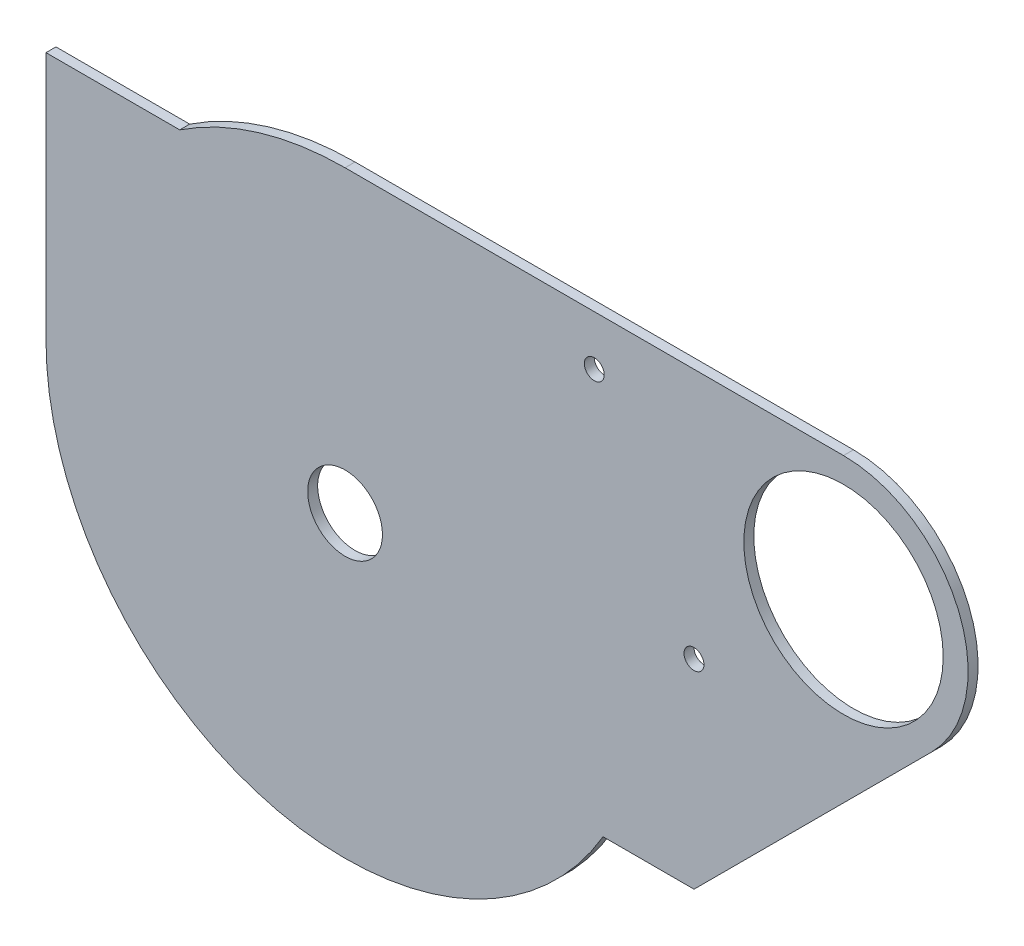
from build123d import *

# Parameters (mm, degrees)
SKETCH1_R           = 20
SKETCH1_R_2         = 7.5
BOSS_EXTRUDE1_DEPTH = 2
CUT_EXTRUDE1_REACH  = 140.669
SKETCH3_R           = 2


with BuildPart() as part:
    # Sketch1 → Boss-Extrude1 (new body)
    # profile 1 of 2: a face of its own
    with BuildSketch(Plane.XY):
        with BuildLine():
            ThreePointArc((-60, 0), (-52.867640737, 28.372743309), (-33.166247904, 50))
            Line((-33.166247904, 50), (-60, 50))
            Line((-60, 50), (-60, 0))
        make_face()
    # profile 2 of 2: a face of its own
    with BuildSketch(Plane.XY):
        with BuildLine():
            Line((117.67766953, 17.32233047), (70.010033914, -30.345305145))
            Line((70.010033914, -30.345305145), (51.7606265, -30.345305145))
            ThreePointArc((51.7606265, -30.345305145), (-52.061109807, -29.826847732), (0, 60))
            Line((0, 60), (100, 60))
            ThreePointArc((100, 60), (123.096988313, 44.567085809), (117.67766953, 17.32233047))
        make_face()
        with Locations((100, 35)):
            Circle(SKETCH1_R, mode=Mode.SUBTRACT)
        Circle(SKETCH1_R_2, mode=Mode.SUBTRACT)
    extrude(amount=BOSS_EXTRUDE1_DEPTH)

    # Sketch3 → Cut-Extrude1 (cut, up to next)
    with BuildSketch(Plane.XY.offset(2), mode=Mode.PRIVATE) as cut_extrude1_sk1:
        with Locations((50, 50)):
            Circle(SKETCH3_R)
    cut_extrude1_tool1 = extrude(cut_extrude1_sk1.sketch, amount=-CUT_EXTRUDE1_REACH, mode=Mode.PRIVATE) & part.part
    # Sketch3 → Cut-Extrude1 (cut, up to next)
    with BuildSketch(Plane.XY.offset(2), mode=Mode.PRIVATE) as cut_extrude1_sk2:
        with Locations((70, 9.654694855)):
            Circle(SKETCH3_R)
    cut_extrude1_tool2 = extrude(cut_extrude1_sk2.sketch, amount=-CUT_EXTRUDE1_REACH, mode=Mode.PRIVATE) & part.part
    add(cut_extrude1_tool1.solids().sort_by_distance((50, 50, 2))[0], mode=Mode.SUBTRACT)
    add(cut_extrude1_tool2.solids().sort_by_distance((70, 9.654695, 2))[0], mode=Mode.SUBTRACT)


solid = part.part
